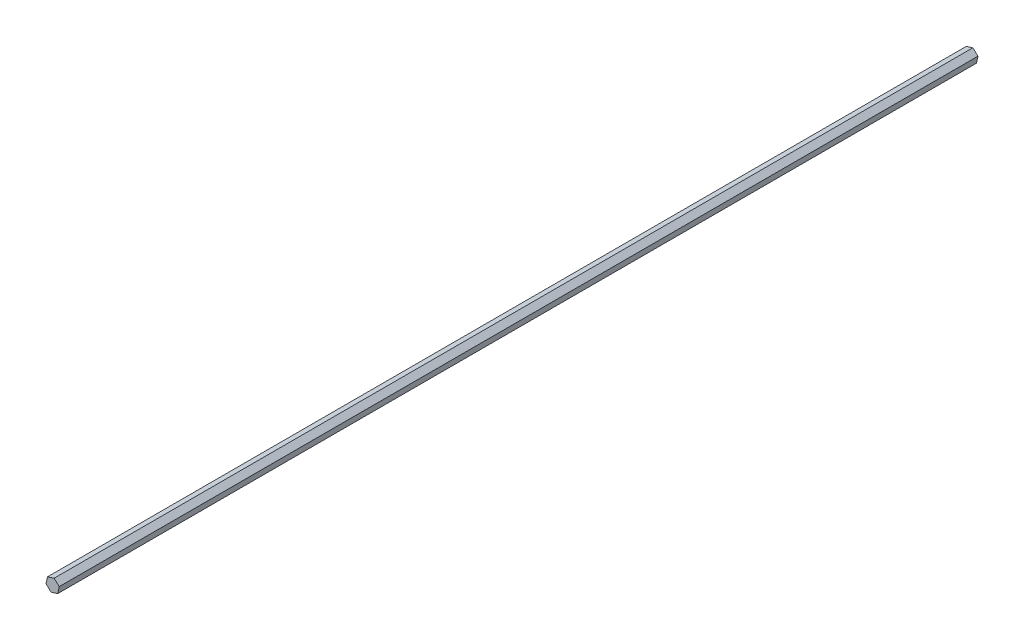
from build123d import *

# Parameters (mm, degrees)
BOSS_EXTRUDE1_DEPTH = 381


with BuildPart() as part:
    # Sketch1 → Boss-Extrude1 (new body)
    with BuildSketch(Plane.XY):
        Polygon((2.137295047, -1.940438924), (2.749116926, 0.880732344), (0.611821879, 2.821171268), (-2.137295047, 1.940438924), (-2.749116926, -0.880732344), (-0.611821879, -2.821171268), align=None)
    extrude(amount=BOSS_EXTRUDE1_DEPTH)


solid = part.part
